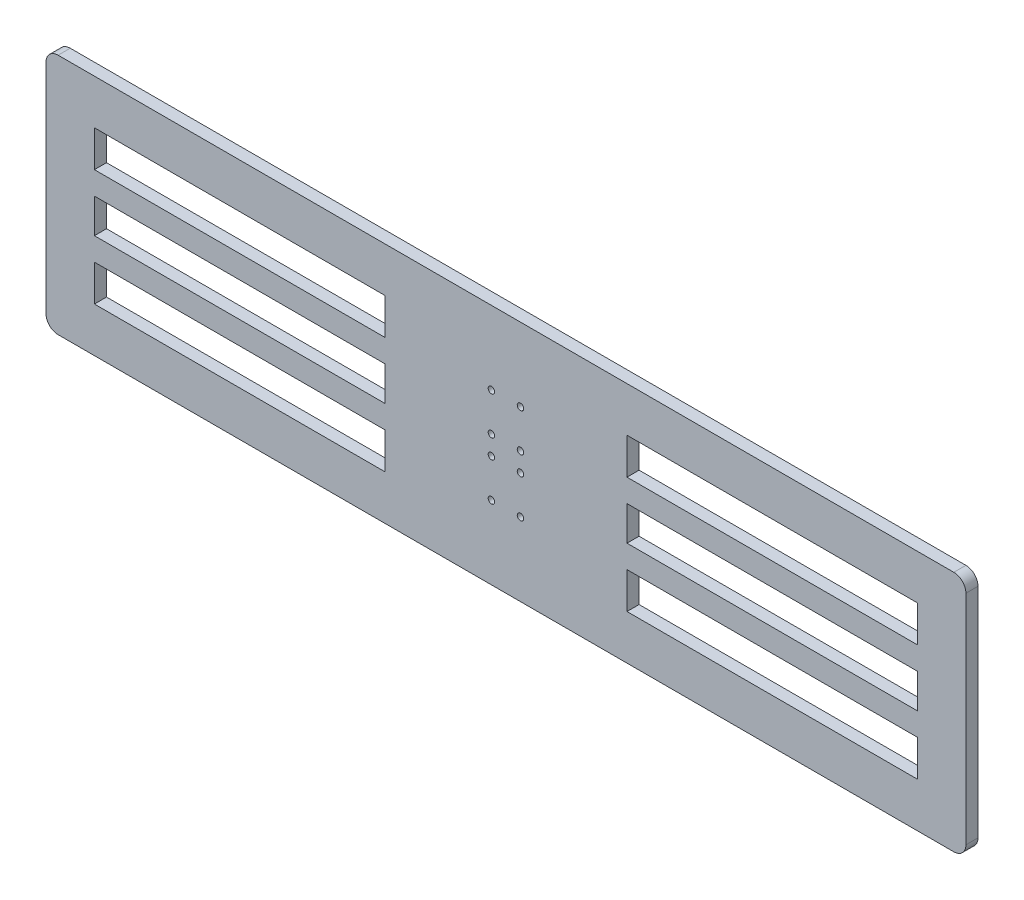
from build123d import *

# Parameters (mm, degrees)
SKETCH1_W            = 482.6
SKETCH1_H            = 101.6
SKETCH1_W_2          = 152.4
SKETCH1_H_2          = 19.05
SKETCH1_H_3          = 18
BOSS_EXTRUDE1_DEPTH  = 6.35
M3_CLEARANCE_HOLE1_D = 3.4
SKETCH4_W            = 482.6
SKETCH4_H            = 12.7
BOSS_EXTRUDE2_DEPTH  = 6.35
FILLET2_R            = 6.35


with BuildPart() as part:
    # Sketch1 → Boss-Extrude1 (new body)
    with BuildSketch(Plane.XY):
        Rectangle(SKETCH1_W, SKETCH1_H)
        with Locations((-139.7, -30.525)):
            Rectangle(SKETCH1_W_2, SKETCH1_H_2, mode=Mode.SUBTRACT)
        with Locations((139.7, -30.525)):
            Rectangle(SKETCH1_W_2, SKETCH1_H_2, mode=Mode.SUBTRACT)
        with Locations((-139.7, 0)):
            Rectangle(SKETCH1_W_2, SKETCH1_H_3, mode=Mode.SUBTRACT)
        with Locations((-139.7, 30.525)):
            Rectangle(SKETCH1_W_2, SKETCH1_H_2, mode=Mode.SUBTRACT)
        with Locations((139.7, 0)):
            Rectangle(SKETCH1_W_2, SKETCH1_H_3, mode=Mode.SUBTRACT)
        with Locations((139.7, 30.525)):
            Rectangle(SKETCH1_W_2, SKETCH1_H_2, mode=Mode.SUBTRACT)
    extrude(amount=BOSS_EXTRUDE1_DEPTH)

    # M3 Clearance Hole1 (through all)
    with Locations(Plane.XY.offset(6.35)):
        with Locations((7.625, 5), (7.625, 25), (7.625, -5), (-7.625, 25), (-7.625, 5), (7.625, -25), (-7.625, -25), (-7.625, -5)):
            Hole(M3_CLEARANCE_HOLE1_D / 2)

    # Sketch4 → Boss-Extrude2 (add)
    with BuildSketch(Plane(origin=(0, 0, 0), x_dir=(-1, 0, 0), z_dir=(0, 0, -1))):
        with Locations((0, -57.15)):
            Rectangle(SKETCH4_W, SKETCH4_H)
        with Locations((0, 57.15)):
            Rectangle(SKETCH4_W, SKETCH4_H)
    extrude(amount=-BOSS_EXTRUDE2_DEPTH)

    # Fillet2
    fillet2_edges = [part.edges().sort_by_distance(p)[0] for p in [
        (241.3, -63.5, 3.175),
        (-241.3, -63.5, 3.175),
        (241.3, 63.5, 3.175),
        (-241.3, 63.5, 3.175),
    ]]
    fillet(fillet2_edges, radius=FILLET2_R)


solid = part.part
